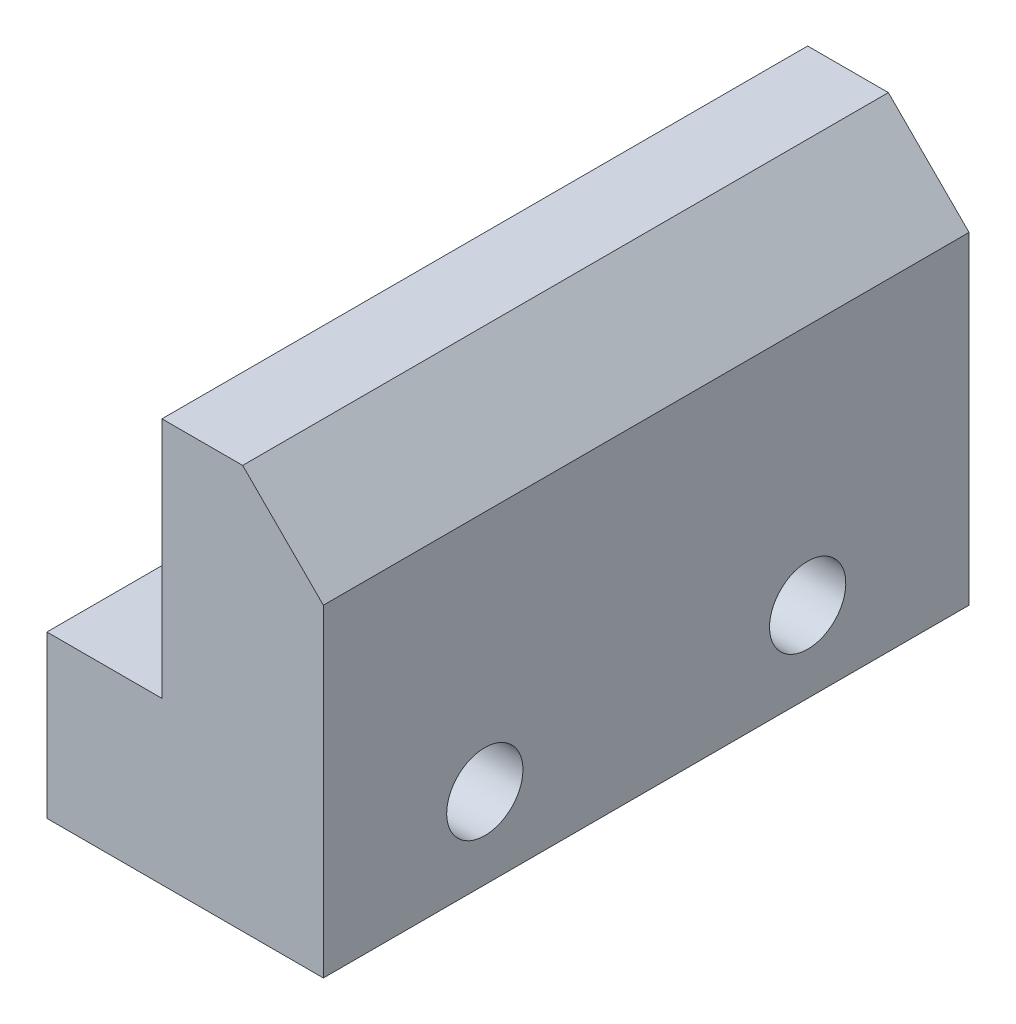
from build123d import *

# Parameters (mm, degrees)
BOSS_EXTRUDE1_DEPTH = 50.8
SKETCH2_R           = 3.25
CUT_EXTRUDE1_DEPTH  = 84.985296332
SKETCH3_R           = 6
CUT_EXTRUDE2_DEPTH  = 33.5


with BuildPart() as part:
    # Sketch1 → Boss-Extrude1 (new, symmetric)
    with BuildSketch(Plane.XY):
        Polygon((43.5, 38.1), (30.8, 50.8), (18.1, 50.8), (18.1, 12.7), (0, 12.7), (0, -12.7), (43.5, -12.7), align=None)
    extrude(amount=BOSS_EXTRUDE1_DEPTH, both=True)

    # Sketch2 → Cut-Extrude1 (cut, through all)
    with BuildSketch(Plane(origin=(43.5, 0, 0), x_dir=(0, 0, -1), z_dir=(1, 0, 0))):
        with Locations(Location((-25.4, 0, 0), (0, 0, 90))):
            Circle(SKETCH2_R)
        with Locations(Location((25.4, 0, 0), (0, 0, 90))):
            Circle(SKETCH2_R)
    extrude(amount=-CUT_EXTRUDE1_DEPTH, mode=Mode.SUBTRACT)

    # Sketch3 → Cut-Extrude2 (cut)
    with BuildSketch(Plane(origin=(43.5, 0, 0), x_dir=(0, 0, -1), z_dir=(1, 0, 0))):
        with Locations(Location((-25.4, 0, 0), (0, 0, 90))):
            Circle(SKETCH3_R)
        with Locations(Location((25.4, 0, 0), (0, 0, 90))):
            Circle(SKETCH3_R)
    extrude(amount=-CUT_EXTRUDE2_DEPTH, mode=Mode.SUBTRACT)


solid = part.part
